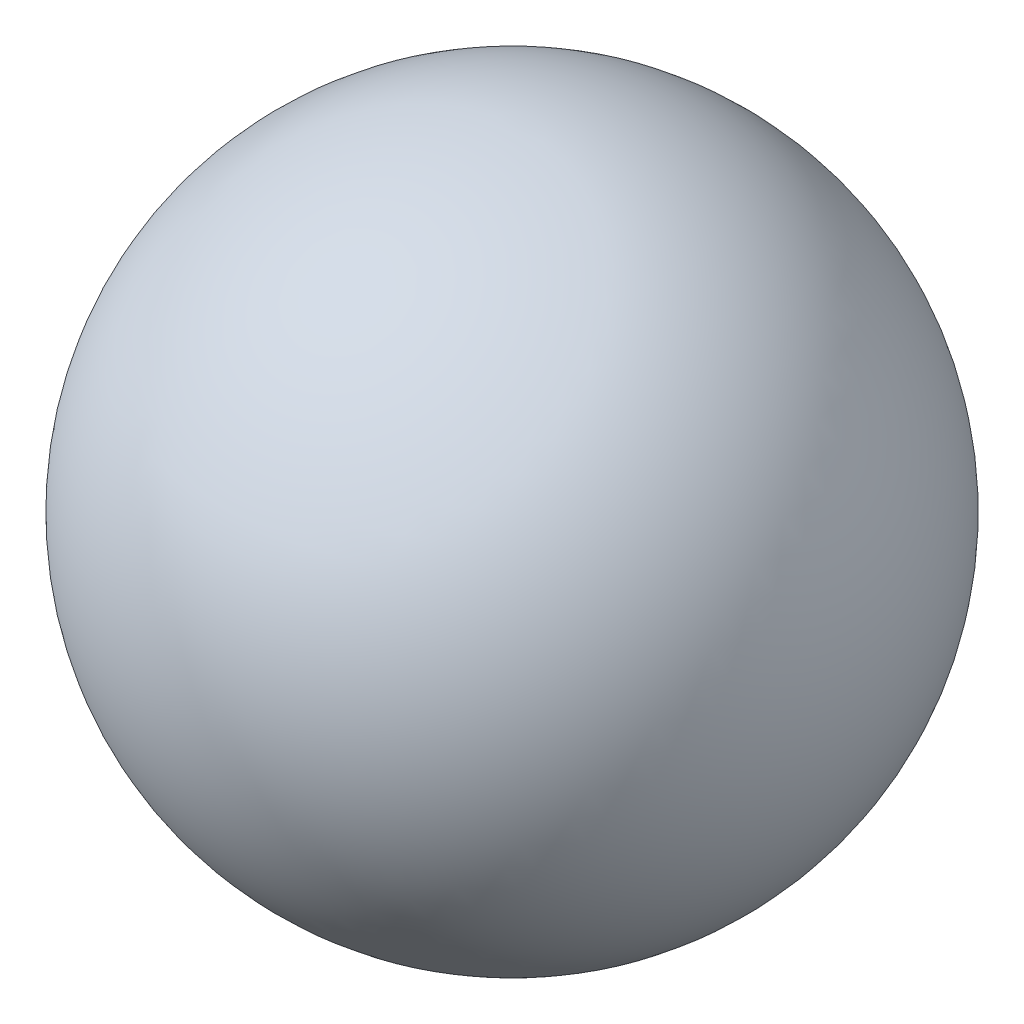
from build123d import *


with BuildPart() as part:
    # Sketch1 → Revolve5 (revolve)
    with BuildSketch(Plane(origin=(0, 0, 0), x_dir=(0, 0, -1), z_dir=(1, 0, 0))):
        with BuildLine():
            Line((0, -12), (0, 12))
            ThreePointArc((0, 12), (12, 0), (0, -12))
        make_face()
    revolve(axis=Axis((0, -12, 0), (0, 1, 0)))


solid = part.part
